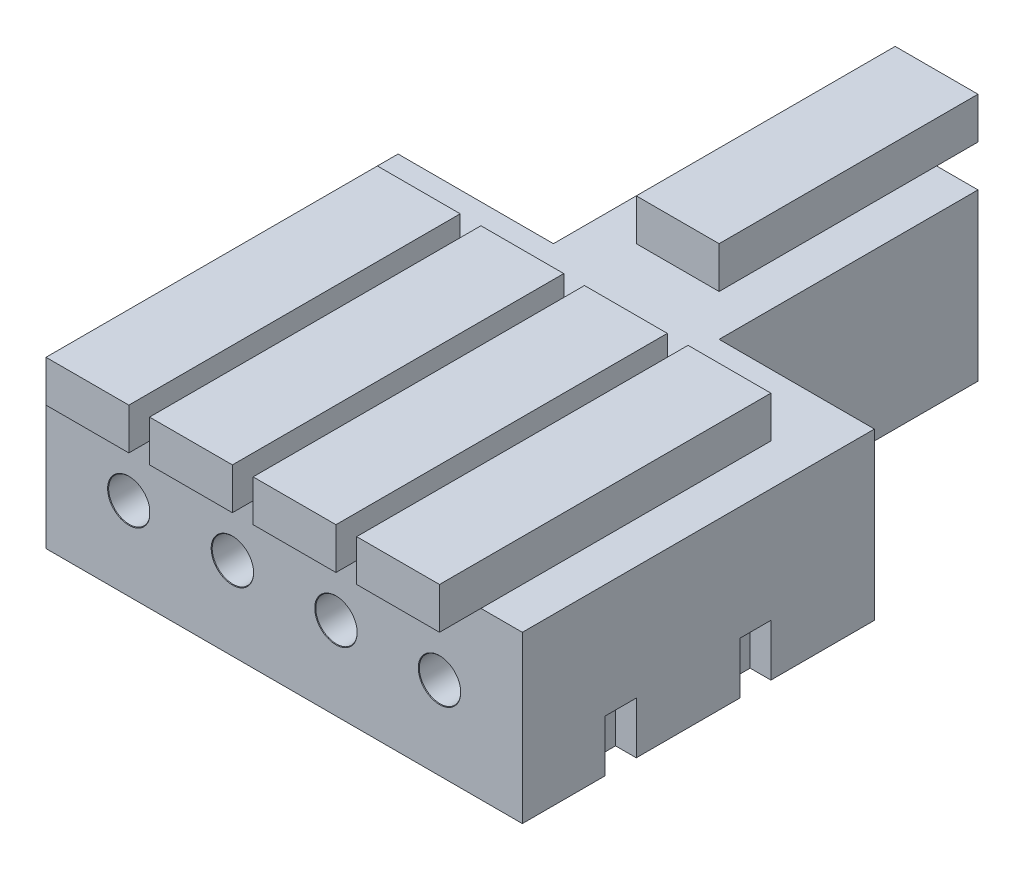
from build123d import *

# Parameters (mm, degrees)
SKETCH1_W                  = 8
SKETCH1_H                  = 17
CONNECTOR_BODY_DEPTH       = 8
SKETCH4_W                  = 4
SKETCH4_H                  = 16
CLAMP_DEPTH                = 2
CONNECTOR_PATTERN_COUNT    = 4
CONNECTOR_PATTERN_PITCH    = 5
SKETCH5_W                  = 8
SKETCH5_H                  = 12.5
SINGLE_BODY_DEPTH          = 8
SKETCH6_W                  = 1.5
SKETCH6_H                  = 2.500390225
CHAINING_NOBS_DEPTH        = 1
SKETCH7_W                  = 1
SKETCH7_H                  = 1.5
CHAINING_NOBS_CUTOUT_DEPTH = 2.50039
SKETCH8_W                  = 4
SKETCH8_H                  = 12.5
SINGLE_BODY_CLAMP_DEPTH    = 2
SKETCH9_R                  = 2.25
SKETCH9_R_2                = 1.5
MOUNTING_RINGS_DEPTH       = 2


with BuildPart() as part:
    # Sketch1 → connector_body (new body)
    with BuildSketch(Plane(origin=(0, 0, 0), x_dir=(1, 0, 0), z_dir=(0, 1, 0))):
        with Locations((4, 8.5)):
            Rectangle(SKETCH1_W, SKETCH1_H)
    connector_body = extrude(amount=CONNECTOR_BODY_DEPTH)

    # Sketch3 → cable_hole (revolve, cut)
    with BuildSketch(Plane(origin=(4, 4, 0), x_dir=(0, -1, 0), z_dir=(1, 0, 0))):
        Polygon((0, 0), (0, 10.600860619), (1, 10), (1, 0.025), (1.025, 0), align=None)
    cable_hole = revolve(axis=Axis((4, 4, 6.35), (0, 0, -1)), mode=Mode.SUBTRACT)

    # Sketch4 → clamp (add)
    with BuildSketch(Plane(origin=(0, 8, 0), x_dir=(1, 0, 0), z_dir=(0, 1, 0))):
        with Locations((4, 6)):
            Rectangle(SKETCH4_W, SKETCH4_H)
    clamp = extrude(amount=CLAMP_DEPTH)

    # connector_pattern: connector_body, cable_hole, clamp ×4
    with Locations(*[(i * CONNECTOR_PATTERN_PITCH, 0, 0) for i in range(1, CONNECTOR_PATTERN_COUNT)]):
        add(connector_body)
        add(cable_hole, mode=Mode.SUBTRACT)
        add(clamp)

    # Sketch5 → single_body (add)
    with BuildSketch(Plane(origin=(0, 8, 0), x_dir=(1, 0, 0), z_dir=(0, 1, 0))):
        with Locations((11.5, 23.25)):
            Rectangle(SKETCH5_W, SKETCH5_H)
    extrude(amount=-SINGLE_BODY_DEPTH)

    # Sketch6 → chaining_nobs (add)
    with BuildSketch(Plane.ZY):
        with Locations((-11.25, 1.250195113)):
            Rectangle(SKETCH6_W, SKETCH6_H)
        with Locations((-4.75, 1.250195113)):
            Rectangle(SKETCH6_W, SKETCH6_H)
    extrude(amount=CHAINING_NOBS_DEPTH)

    # Sketch7 → chaining_nobs_cutout (cut)
    with BuildSketch(Plane.XZ):
        with Locations((22.5, -4.75)):
            Rectangle(SKETCH7_W, SKETCH7_H)
        with Locations((22.5, -11.25)):
            Rectangle(SKETCH7_W, SKETCH7_H)
    extrude(amount=-CHAINING_NOBS_CUTOUT_DEPTH, mode=Mode.SUBTRACT)

    # Sketch8 → single_body_clamp (add)
    with BuildSketch(Plane(origin=(0, 8, 0), x_dir=(1, 0, 0), z_dir=(0, 1, 0))):
        with Locations((11.5, 25.25)):
            Rectangle(SKETCH8_W, SKETCH8_H)
    extrude(amount=SINGLE_BODY_CLAMP_DEPTH)

    # Sketch9 → mounting_rings (add)
    # profile 1 of 2: a face of its own
    with BuildSketch(Plane.XZ):
        with Locations((5.5, -19)):
            Circle(SKETCH9_R)
        with Locations(Location((5.5, -19, 0), (0, 0, 270))):
            Circle(SKETCH9_R_2, mode=Mode.SUBTRACT)
    # profile 2 of 2: a face of its own
    with BuildSketch(Plane.XZ):
        with Locations((17.5, -19)):
            Circle(SKETCH9_R)
        with Locations(Location((17.5, -19, 0), (0, 0, 270))):
            Circle(SKETCH9_R_2, mode=Mode.SUBTRACT)
    extrude(amount=-MOUNTING_RINGS_DEPTH)


solid = part.part
